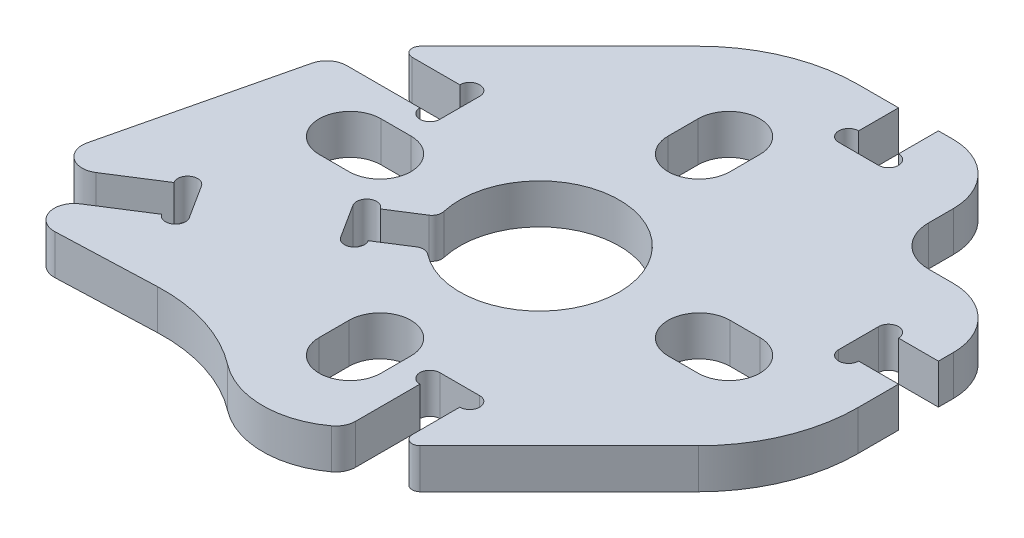
from build123d import *

# Parameters (mm, degrees)
BOSS_EXTRUDE1_DEPTH = 2


with BuildPart() as part:
    # Sketch2 → Boss-Extrude1 (new body)
    with BuildSketch(Plane(origin=(0, 0, 0), x_dir=(1, 0, 0), z_dir=(0, 1, 0))):
        with BuildLine():
            Line((-10.683420839, 7.453272885), (-10.683420839, 5.453272885))
            ThreePointArc((-10.683420839, 5.453272885), (-11.183420839, 4.953272885), (-11.683420839, 5.453272885))
            Line((-11.683420839, 5.453272885), (-15.35489401, 5.453272885))
            ThreePointArc((-15.35489401, 5.453272885), (-15.974254556, 5.238379575), (-16.327422226, 4.686057913))
            Line((-16.327422226, 4.686057913), (-18.502568846, -4.401259626))
            ThreePointArc((-18.502568846, -4.401259626), (-18.110467141, -5.448357286), (-16.992741021, -5.477436099))
            Line((-16.992741021, -5.477436099), (-14.606504965, -3.957236073))
            ThreePointArc((-14.606504965, -3.957236073), (-14.453459047, -3.266890545), (-13.76311352, -3.419936464))
            Line((-13.76311352, -3.419936464), (-12.688514303, -5.106719356))
            ThreePointArc((-12.688514303, -5.106719356), (-12.841560222, -5.797064883), (-13.531905749, -5.644018964))
            Line((-13.531905749, -5.644018964), (-16.026002021, -7.232933527))
            ThreePointArc((-16.026002021, -7.232933527), (-16.443355206, -8.374046414), (-15.451333197, -9.075626513))
            Line((-15.451333197, -9.075626513), (-10.493019061, -8.890208712))
            ThreePointArc((-10.493019061, -8.890208712), (-7.77384357, -9.259496243), (-5.339433215, -10.525961738))
            ThreePointArc((-5.339433215, -10.525961738), (-2.723247428, -11.423772675), (-0.091156592, -10.57371951))
            ThreePointArc((-0.091156592, -10.57371951), (0.208841524, -10.219493021), (0.316579161, -9.767975715))
            Line((0.316579161, -9.767975715), (0.316579161, -6.547082806))
            ThreePointArc((0.316579161, -6.547082806), (-0.183420839, -6.047082806), (0.316579161, -5.547082806))
            Line((0.316579161, -5.547082806), (2.316579161, -5.547082806))
            ThreePointArc((2.316579161, -5.547082806), (2.816579161, -6.047082806), (2.316579161, -6.547082806))
            Line((2.316579161, -6.547082806), (2.316579161, -8.930282652))
            ThreePointArc((2.316579161, -8.930282652), (2.563505788, -9.299834465), (2.999421874, -9.213125364))
            Line((2.999421874, -9.213125364), (9.973433411, -2.239113827))
            ThreePointArc((9.973433411, -2.239113827), (11.707615421, 0.356272963), (12.316579161, 3.417740422))
            Line((12.316579161, 3.417740422), (12.316579161, 5.453272885))
            Line((12.316579161, 5.453272885), (10.316579161, 5.453272885))
            ThreePointArc((10.316579161, 5.453272885), (9.816579161, 4.953272885), (9.316579161, 5.453272885))
            Line((9.316579161, 5.453272885), (9.316579161, 7.453272885))
            ThreePointArc((9.316579161, 7.453272885), (9.816579161, 7.953272885), (10.316579161, 7.453272885))
            Line((10.316579161, 7.453272885), (12.316579161, 7.453272885))
            Line((12.316579161, 7.453272885), (12.316579161, 8.202917194))
            ThreePointArc((12.316579161, 8.202917194), (11.437899505, 10.324237538), (9.316579161, 11.202917194))
            Line((9.316579161, 11.202917194), (8.066579161, 11.202917194))
            ThreePointArc((8.066579161, 11.202917194), (6.652365599, 11.788703632), (6.066579161, 13.202917194))
            Line((6.066579161, 13.202917194), (6.066579161, 14.452917194))
            ThreePointArc((6.066579161, 14.452917194), (5.187899505, 16.574237538), (3.066579161, 17.452917194))
            Line((3.066579161, 17.452917194), (2.316579161, 17.452917194))
            Line((2.316579161, 17.452917194), (2.316579161, 15.452917194))
            ThreePointArc((2.316579161, 15.452917194), (2.816579161, 14.952917194), (2.316579161, 14.452917194))
            Line((2.316579161, 14.452917194), (0.316579161, 14.452917194))
            ThreePointArc((0.316579161, 14.452917194), (-0.183420839, 14.952917194), (0.316579161, 15.452917194))
            Line((0.316579161, 15.452917194), (0.316579161, 17.453272885))
            Line((0.316579161, 17.453272885), (-1.718597611, 17.453272885))
            ThreePointArc((-1.718597611, 17.453272885), (-4.78006507, 16.844309145), (-7.37545186, 15.110127135))
            Line((-7.37545186, 15.110127135), (-14.349463397, 8.136115598))
            ThreePointArc((-14.349463397, 8.136115598), (-14.436172498, 7.700199512), (-14.066620685, 7.453272885))
            Line((-14.066620685, 7.453272885), (-11.683420839, 7.453272885))
            ThreePointArc((-11.683420839, 7.453272885), (-11.183420839, 7.953272885), (-10.683420839, 7.453272885))
        make_face()
        with BuildLine():
            Line((-1.133420839, 11.952917194), (-1.133420839, 10.452917194))
            ThreePointArc((-1.133420839, 10.452917194), (-2.683420839, 8.902917194), (-4.233420839, 10.452917194))
            Line((-4.233420839, 10.452917194), (-4.233420839, 11.952917194))
            ThreePointArc((-4.233420839, 11.952917194), (-2.683420839, 13.502917194), (-1.133420839, 11.952917194))
        make_face(mode=Mode.SUBTRACT)
        with BuildLine():
            Line((5.316579161, 4.002917194), (6.816579161, 4.002917194))
            ThreePointArc((6.816579161, 4.002917194), (8.366579161, 2.452917194), (6.816579161, 0.902917194))
            Line((6.816579161, 0.902917194), (5.316579161, 0.902917194))
            ThreePointArc((5.316579161, 0.902917194), (3.766579161, 2.452917194), (5.316579161, 4.002917194))
        make_face(mode=Mode.SUBTRACT)
        with BuildLine():
            Line((-1.133420839, -5.547082806), (-1.133420839, -7.047082806))
            ThreePointArc((-1.133420839, -7.047082806), (-2.683420839, -8.597082806), (-4.233420839, -7.047082806))
            Line((-4.233420839, -7.047082806), (-4.233420839, -5.547082806))
            ThreePointArc((-4.233420839, -5.547082806), (-2.683420839, -3.997082806), (-1.133420839, -5.547082806))
        make_face(mode=Mode.SUBTRACT)
        with BuildLine():
            Line((-10.683420839, 0.902917194), (-12.183420839, 0.902917194))
            ThreePointArc((-12.183420839, 0.902917194), (-13.733420839, 2.452917194), (-12.183420839, 4.002917194))
            Line((-12.183420839, 4.002917194), (-10.683420839, 4.002917194))
            ThreePointArc((-10.683420839, 4.002917194), (-9.133420839, 2.452917194), (-10.683420839, 0.902917194))
        make_face(mode=Mode.SUBTRACT)
        with BuildLine():
            Line((-8.281069122, 0.07251099), (-6.79892731, 1.016739461))
            ThreePointArc((-6.79892731, 1.016739461), (-6.604759329, 1.249227104), (-6.580448639, 1.551155407))
            ThreePointArc((-6.580448639, 1.551155407), (0.690144945, 4.602115628), (-5.147649684, -0.697888449))
            ThreePointArc((-5.147649684, -0.697888449), (-5.431563797, -0.592321001), (-5.724328093, -0.670043431))
            Line((-5.724328093, -0.670043431), (-7.206469905, -1.614271902))
            ThreePointArc((-7.206469905, -1.614271902), (-7.359515824, -2.304617429), (-8.049861351, -2.15157151))
            Line((-8.049861351, -2.15157151), (-9.124460568, -0.464788618))
            ThreePointArc((-9.124460568, -0.464788618), (-8.971414649, 0.225556909), (-8.281069122, 0.07251099))
        make_face(mode=Mode.SUBTRACT)
    extrude(amount=BOSS_EXTRUDE1_DEPTH)


solid = part.part
